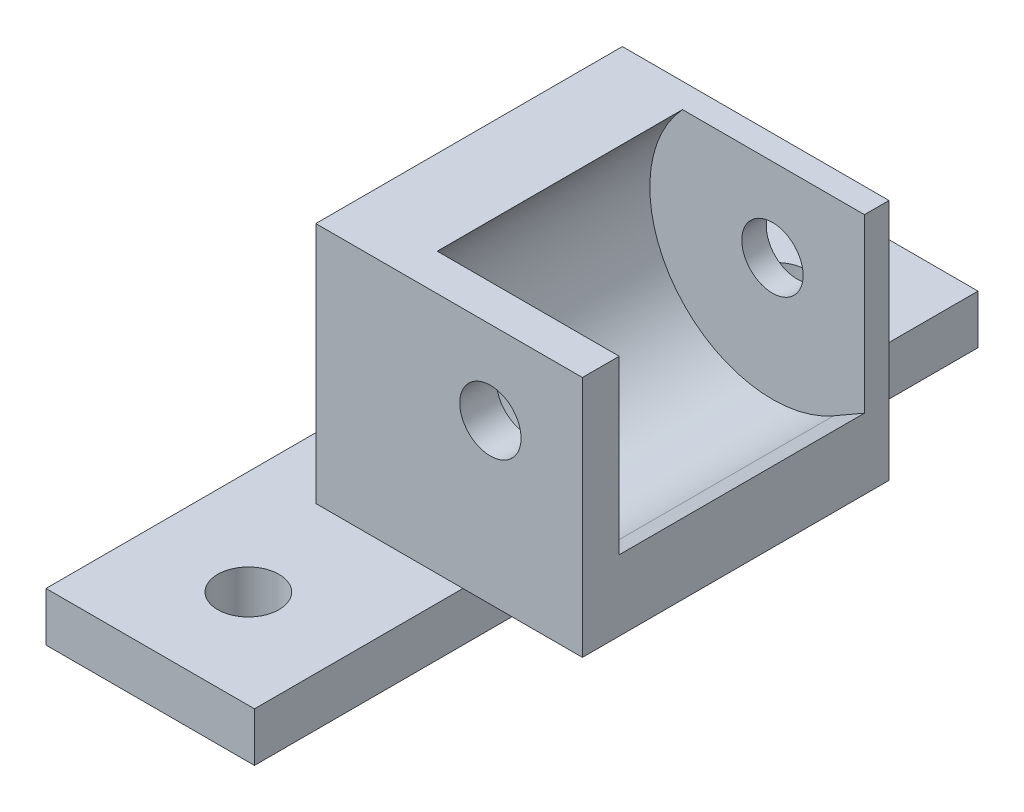
from build123d import *

# Parameters (mm, degrees)
BOSS_EXTRUDE1_DEPTH = 27.94
SKETCH2_R           = 3.175
BOSS_EXTRUDE2_DEPTH = 2.54
BOSS_EXTRUDE3_START = 3.81
SKETCH3_W           = 27.611756562
SKETCH3_H           = 25.107614127
SKETCH3_R           = 3.175
BOSS_EXTRUDE3_DEPTH = 3.81
SKETCH4_W           = 21.59
SKETCH4_H           = 74.93
SKETCH4_R           = 3.175
BOSS_EXTRUDE4_DEPTH = 5.08


with BuildPart() as part:
    # Sketch1 → Boss-Extrude1 (new body)
    with BuildSketch(Plane.XY):
        with BuildLine():
            Line((-518.959059009, 348.633589309), (-527.727560082, 348.633589309))
            Line((-527.727560082, 348.633589309), (-527.727560082, 323.525975182))
            Line((-527.727560082, 323.525975182), (-500.11580352, 323.525975182))
            Line((-500.11580352, 323.525975182), (-500.11580352, 330.828951218))
            Line((-500.11580352, 330.828951218), (-503.31589155, 328.989459324))
            ThreePointArc((-503.31589155, 328.989459324), (-505.910190066, 327.86159111), (-508.689794246, 327.335975182))
            ThreePointArc((-508.689794246, 327.335975182), (-520.655570716, 333.67086151), (-520.107560082, 347.198990562))
            ThreePointArc((-520.107560082, 347.198990562), (-519.559291988, 347.937090778), (-518.959059009, 348.633589309))
        make_face()
    extrude(amount=-BOSS_EXTRUDE1_DEPTH)

    # Sketch2 → Boss-Extrude2 (add)
    with BuildSketch(Plane(origin=(0, 0, -25.4), x_dir=(-1, 0, 0), z_dir=(0, 0, -1))):
        with BuildLine():
            Line((500.11580352, 330.828951218), (500.11580352, 348.633589309))
            Line((500.11580352, 348.633589309), (518.959059009, 348.633589309))
            ThreePointArc((518.959059009, 348.633589309), (519.579835197, 332.088638139), (503.31589155, 328.989459324))
            Line((503.31589155, 328.989459324), (500.11580352, 330.828951218))
        make_face()
        with Locations(Location((509.64503004, 340, 0), (0, 0, 180))):
            Circle(SKETCH2_R, mode=Mode.SUBTRACT)
    extrude(amount=BOSS_EXTRUDE2_DEPTH)

    # Sketch3 → Boss-Extrude3 (add)
    with BuildSketch(Plane.XY.offset(BOSS_EXTRUDE3_START)):
        with Locations((-513.921681801, 336.079782246)):
            Rectangle(SKETCH3_W, SKETCH3_H)
        with Locations((-509.64503004, 340)):
            Circle(SKETCH3_R, mode=Mode.SUBTRACT)
    extrude(amount=-BOSS_EXTRUDE3_DEPTH)

    # Sketch4 → Boss-Extrude4 (add)
    with BuildSketch(Plane(origin=(0, 323.525975182, 0), x_dir=(1, 0, 0), z_dir=(0, 1, 0))):
        with Locations((-523.282560082, 12.065)):
            Rectangle(SKETCH4_W, SKETCH4_H)
        with Locations(Location((-523.282560082, -15.24, 0), (0, 0, 270))):
            Circle(SKETCH4_R, mode=Mode.SUBTRACT)
        with Locations(Location((-523.282560082, 39.37, 0), (0, 0, 270))):
            Circle(SKETCH4_R, mode=Mode.SUBTRACT)
    extrude(amount=-BOSS_EXTRUDE4_DEPTH)


solid = part.part
